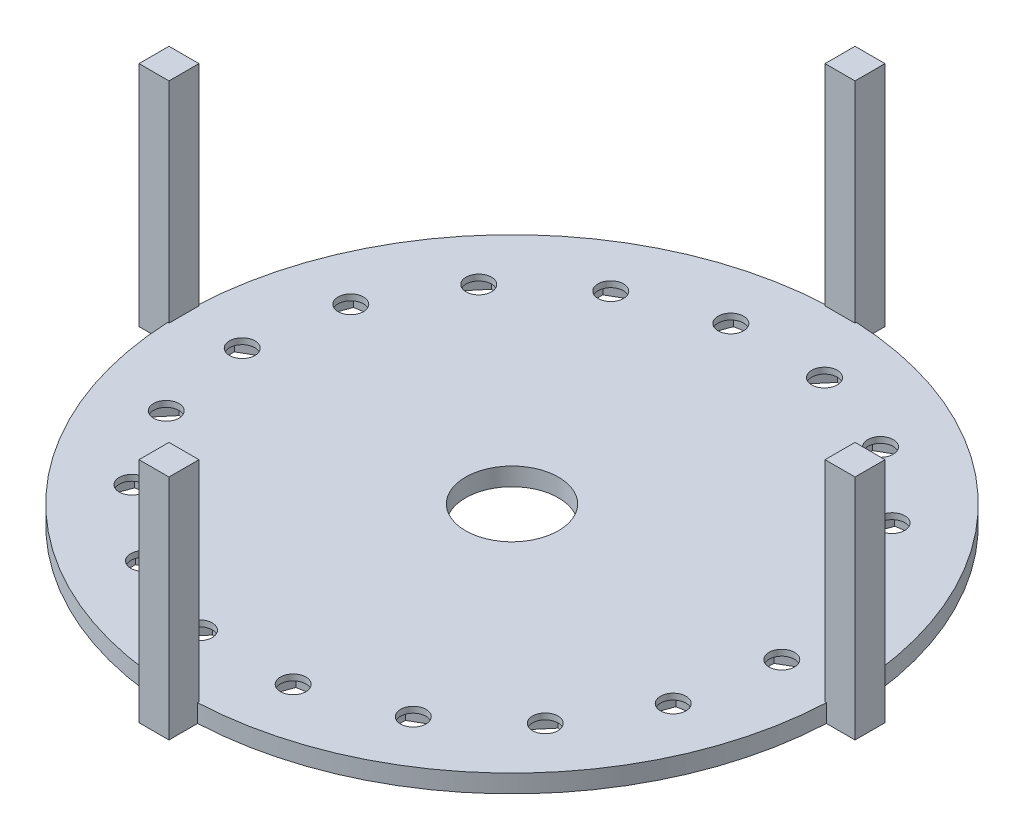
from build123d import *

# Parameters (mm, degrees)
SKETCH1_R           = 110
SKETCH1_R_2         = 4.25
SKETCH1_R_3         = 15.5
BOSS_EXTRUDE1_DEPTH = 6
CUT_EXTRUDE1_START  = -2
CUT_EXTRUDE1_DEPTH  = 6
BOSS_EXTRUDE3_START = -6
SKETCH4_W           = 10
SKETCH4_H           = 10
BOSS_EXTRUDE3_DEPTH = 76


with BuildPart() as part:
    # Sketch1 → Boss-Extrude1 (new body)
    with BuildSketch(Plane(origin=(0, 0, 0), x_dir=(1, 0, 0), z_dir=(0, 1, 0))):
        with Locations(Location((0, 0, 0), (0, 0, 270))):
            Circle(SKETCH1_R)
        with Locations(Location((-90, 0, 0), (0, 0, 270))):
            Circle(SKETCH1_R_2, mode=Mode.SUBTRACT)
        with Locations(Location((-84.572335871, 30.781812899, 0), (0, 0, 270))):
            Circle(SKETCH1_R_2, mode=Mode.SUBTRACT)
        with Locations(Location((-68.943999881, 57.850884872, 0), (0, 0, 270))):
            Circle(SKETCH1_R_2, mode=Mode.SUBTRACT)
        with Locations(Location((-45, 77.942286341, 0), (0, 0, 270))):
            Circle(SKETCH1_R_2, mode=Mode.SUBTRACT)
        with Locations(Location((-15.62833599, 88.632697771, 0), (0, 0, 270))):
            Circle(SKETCH1_R_2, mode=Mode.SUBTRACT)
        with Locations(Location((15.62833599, 88.632697771, 0), (0, 0, 270))):
            Circle(SKETCH1_R_2, mode=Mode.SUBTRACT)
        with Locations(Location((45, 77.942286341, 0), (0, 0, 270))):
            Circle(SKETCH1_R_2, mode=Mode.SUBTRACT)
        with Locations(Location((68.943999881, 57.850884872, 0), (0, 0, 270))):
            Circle(SKETCH1_R_2, mode=Mode.SUBTRACT)
        with Locations(Location((84.572335871, 30.781812899, 0), (0, 0, 270))):
            Circle(SKETCH1_R_2, mode=Mode.SUBTRACT)
        with Locations(Location((90, 0, 0), (0, 0, 270))):
            Circle(SKETCH1_R_2, mode=Mode.SUBTRACT)
        with Locations(Location((84.572335871, -30.781812899, 0), (0, 0, 270))):
            Circle(SKETCH1_R_2, mode=Mode.SUBTRACT)
        with Locations(Location((68.943999881, -57.850884872, 0), (0, 0, 270))):
            Circle(SKETCH1_R_2, mode=Mode.SUBTRACT)
        with Locations(Location((45, -77.942286341, 0), (0, 0, 270))):
            Circle(SKETCH1_R_2, mode=Mode.SUBTRACT)
        with Locations(Location((15.62833599, -88.632697771, 0), (0, 0, 270))):
            Circle(SKETCH1_R_2, mode=Mode.SUBTRACT)
        with Locations(Location((-15.62833599, -88.632697771, 0), (0, 0, 270))):
            Circle(SKETCH1_R_2, mode=Mode.SUBTRACT)
        with Locations(Location((-45, -77.942286341, 0), (0, 0, 270))):
            Circle(SKETCH1_R_2, mode=Mode.SUBTRACT)
        with Locations(Location((-68.943999881, -57.850884872, 0), (0, 0, 270))):
            Circle(SKETCH1_R_2, mode=Mode.SUBTRACT)
        with Locations(Location((-84.572335871, -30.781812899, 0), (0, 0, 270))):
            Circle(SKETCH1_R_2, mode=Mode.SUBTRACT)
        with Locations(Location((0, 0, 0), (0, 0, 270))):
            Circle(SKETCH1_R_3, mode=Mode.SUBTRACT)
    extrude(amount=BOSS_EXTRUDE1_DEPTH)

    # Sketch2 → Cut-Extrude1 (cut)
    with BuildSketch(Plane(origin=(0, 6, 0), x_dir=(1, 0, 0), z_dir=(0, 1, 0)).offset(CUT_EXTRUDE1_START)):
        Polygon((-87.034881158, 24.016026123), (-79.944265289, 25.266292734), (-77.481720002, 32.032079511), (-82.109790583, 37.547599676), (-89.200406452, 36.297333065), (-91.66295174, 29.531546288), align=None)
        Polygon((-90.000000272, -7.2), (-83.764617229, -3.600000236), (-83.764616957, 3.599999764), (-89.999999728, 7.2), (-96.235382771, 3.600000236), (-96.235383043, -3.599999764), align=None)
        Polygon((-73.572070879, 52.335365056), (-66.481455104, 51.085097909), (-61.853384106, 56.600617725), (-64.315928883, 63.366404687), (-71.406544657, 64.616671834), (-76.034615655, 59.101152019), align=None)
        Polygon((-51.235383043, 74.342286576), (-45.000000272, 70.742286341), (-38.764617229, 74.342286105), (-38.764616957, 81.542286105), (-44.999999728, 85.142286341), (-51.235382771, 81.542286576), align=None)
        Polygon((-22.718951859, 87.38243116), (-18.090881278, 81.866910994), (-11.000265409, 83.117177606), (-8.537720121, 89.882964382), (-13.165790702, 95.398484548), (-20.256406571, 94.148217936), align=None)
        Polygon((8.537720216, 89.882964918), (11.000264992, 83.117177955), (18.090880766, 81.866910808), (22.718951764, 87.382430624), (20.256406988, 94.148217587), (13.165791214, 95.398484734), align=None)
        Polygon((38.764617229, 81.542286576), (38.764616957, 74.342286576), (44.999999728, 70.742286341), (51.235382771, 74.342286105), (51.235383043, 81.542286105), (45.000000272, 85.142286341), align=None)
        Polygon((64.315929299, 63.366405037), (61.853384012, 56.60061826), (66.481454593, 51.085098095), (73.572070462, 52.335364706), (76.03461575, 59.101151483), (71.406545168, 64.616671648), align=None)
        Polygon((82.109791094, 37.547599862), (77.481720096, 32.032080046), (79.944264873, 25.266293084), (87.034880647, 24.016025937), (91.662951645, 29.531545752), (89.200406869, 36.297332715), align=None)
        Polygon((90.000000272, 7.2), (83.764617229, 3.600000236), (83.764616957, -3.599999764), (89.999999728, -7.2), (96.235382771, -3.600000236), (96.235383043, 3.599999764), align=None)
        Polygon((87.034881158, -24.016026123), (79.944265289, -25.266292734), (77.481720002, -32.032079511), (82.109790583, -37.547599676), (89.200406452, -36.297333065), (91.66295174, -29.531546288), align=None)
        Polygon((73.572070879, -52.335365056), (66.481455104, -51.085097909), (61.853384106, -56.600617725), (64.315928883, -63.366404687), (71.406544657, -64.616671834), (76.034615655, -59.101152019), align=None)
        Polygon((51.235383043, -74.342286576), (45.000000272, -70.742286341), (38.764617229, -74.342286105), (38.764616957, -81.542286105), (44.999999728, -85.142286341), (51.235382771, -81.542286576), align=None)
        Polygon((22.718951859, -87.38243116), (18.090881278, -81.866910994), (11.000265409, -83.117177606), (8.537720121, -89.882964382), (13.165790702, -95.398484548), (20.256406571, -94.148217936), align=None)
        Polygon((-8.537720216, -89.882964918), (-11.000264992, -83.117177955), (-18.090880766, -81.866910808), (-22.718951764, -87.382430624), (-20.256406988, -94.148217587), (-13.165791214, -95.398484734), align=None)
        Polygon((-38.764617229, -81.542286576), (-38.764616957, -74.342286576), (-44.999999728, -70.742286341), (-51.235382771, -74.342286105), (-51.235383043, -81.542286105), (-45.000000272, -85.142286341), align=None)
        Polygon((-64.315929299, -63.366405037), (-61.853384012, -56.60061826), (-66.481454593, -51.085098095), (-73.572070462, -52.335364706), (-76.03461575, -59.101151483), (-71.406545168, -64.616671648), align=None)
        Polygon((-82.109791094, -37.547599862), (-77.481720096, -32.032080046), (-79.944264873, -25.266293084), (-87.034880647, -24.016025937), (-91.662951645, -29.531545752), (-89.200406869, -36.297332715), align=None)
    extrude(amount=-CUT_EXTRUDE1_DEPTH, mode=Mode.SUBTRACT)

    # Sketch4 → Boss-Extrude3 (add)
    with BuildSketch(Plane(origin=(0, 6, 0), x_dir=(1, 0, 0), z_dir=(0, 1, 0)).offset(BOSS_EXTRUDE3_START)):
        with Locations((-114.438621766, 0)):
            Rectangle(SKETCH4_W, SKETCH4_H)
        with Locations((114.438621766, 0)):
            Rectangle(SKETCH4_W, SKETCH4_H)
        with Locations((0, -114.438621766)):
            Rectangle(SKETCH4_W, SKETCH4_H)
        with Locations((0, 114.438621766)):
            Rectangle(SKETCH4_W, SKETCH4_H)
    extrude(amount=BOSS_EXTRUDE3_DEPTH)


solid = part.part
